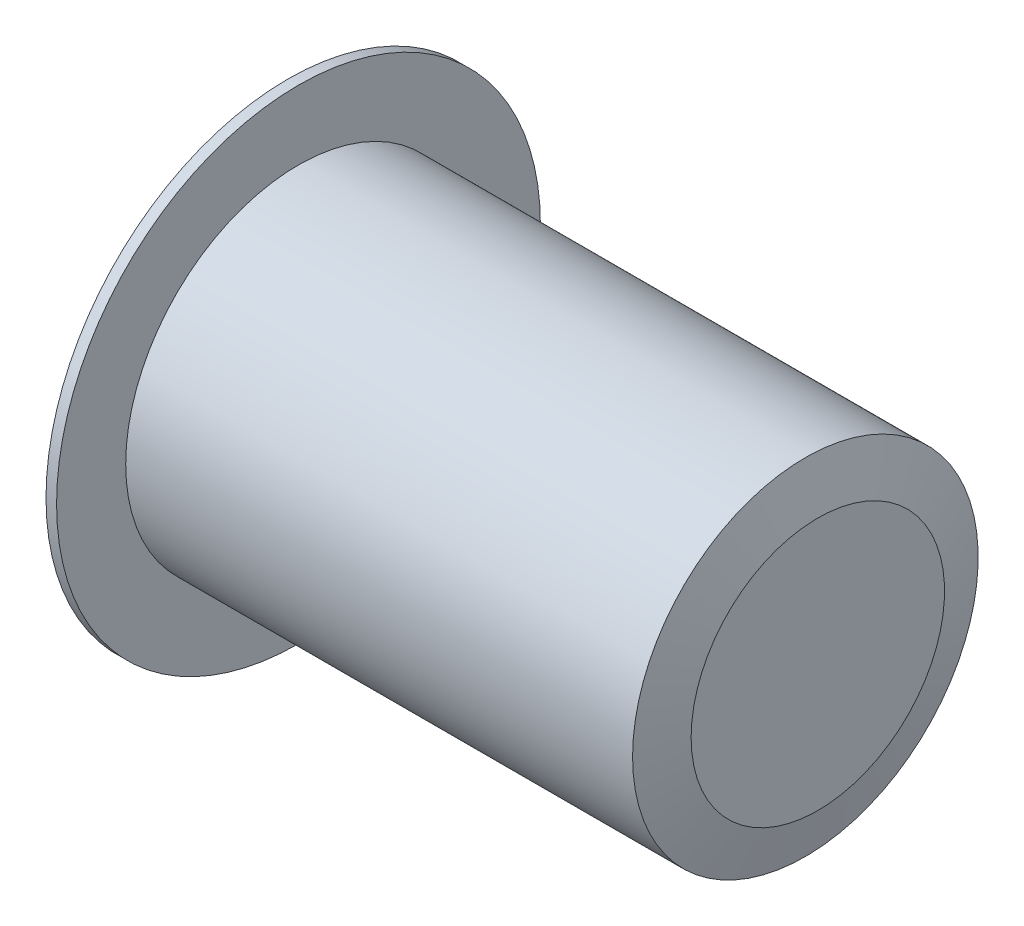
from build123d import *


with BuildPart() as part:
    # Esquisse1 → Révolution1 (revolve)
    with BuildSketch(Plane.XY, mode=Mode.PRIVATE) as r_volution1_sk:
        Polygon((180, 30), (180, 0), (230, 0), (230, 55), (224.590509297, 75), (4.590509297, 75), (4.590509297, 105), (0, 105), (0, 30), align=None)
    revolve(r_volution1_sk.sketch.rotate(Axis((0, 0, 0), (1, 0, 0)), 90), axis=Axis((0, 0, 0), (1, 0, 0)))


solid = part.part
